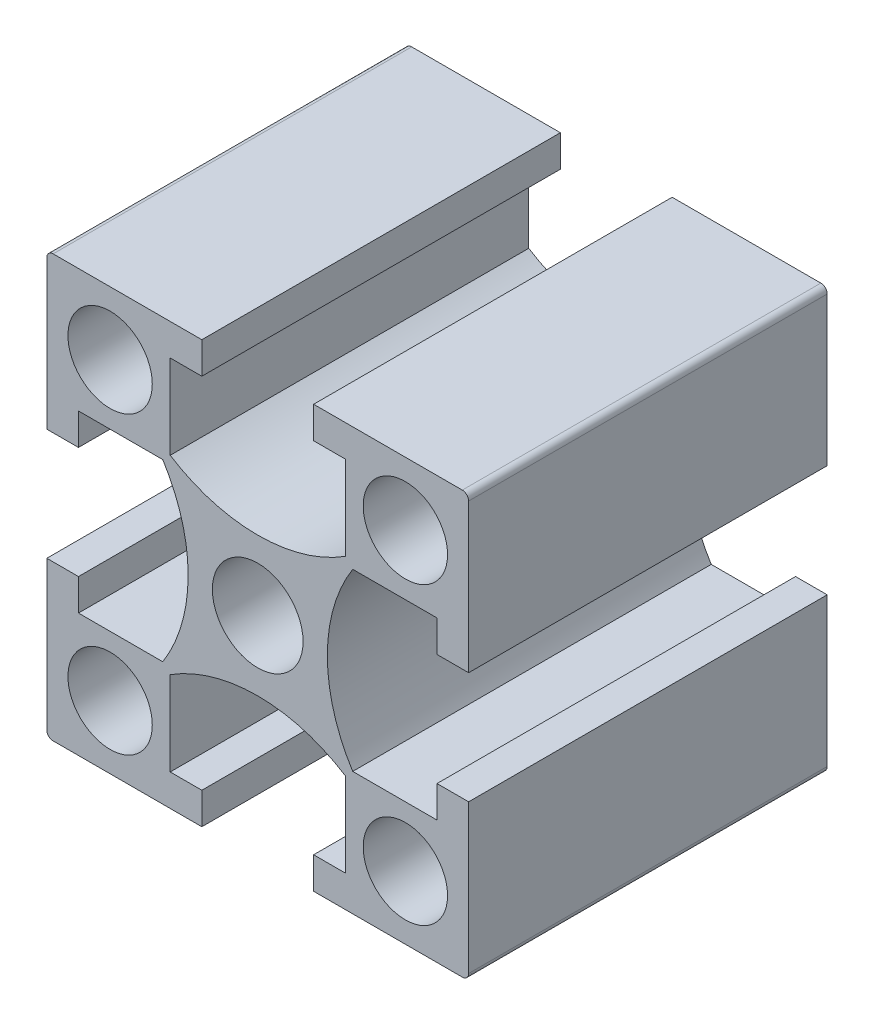
from build123d import *

# Parameters (mm, degrees)
SKETCH_1_W               = 20
SKETCH_1_H               = 20
SKETCH_1_R               = 2
SKETCH_1_R_2             = 2.15
EXTRUDE_1_DEPTH          = 17
CUT_EXTRUDE_1_REACH      = 24.113
PATTERN_CIRCULAR_1_COUNT = 4
FILLET_1_R               = 0.3
CUT_EXTRUDE_2_DEPTH      = 23.113344387
CUT_EXTRUDE_2_DEPTH_BACK = 23.113344387
SKETCH_2_R               = 2.5


with BuildPart() as part:
    # 스케치1 → 보스-돌출1 (new body)
    with BuildSketch(Plane.XY):
        Rectangle(SKETCH_1_W, SKETCH_1_H)
        with Locations((-7, -7)):
            Circle(SKETCH_1_R, mode=Mode.SUBTRACT)
        with Locations((7, -7)):
            Circle(SKETCH_1_R, mode=Mode.SUBTRACT)
        with Locations((-7, 7)):
            Circle(SKETCH_1_R, mode=Mode.SUBTRACT)
        Circle(SKETCH_1_R_2, mode=Mode.SUBTRACT)
        with Locations((7, 7)):
            Circle(SKETCH_1_R, mode=Mode.SUBTRACT)
    extrude(amount=EXTRUDE_1_DEPTH)

    # 스케치1<3> → 컷-돌출1 (cut, up to next)
    with BuildSketch(Plane.XY, mode=Mode.PRIVATE) as cut_extrude_1_sk1:
        with BuildLine():
            Line((-8.5, 2.65), (-10, 2.65))
            Line((-10, 2.65), (-10, -2.65))
            Line((-10, -2.65), (-8.5, -2.65))
            Line((-8.5, -2.65), (-8.5, -4.15))
            Line((-8.5, -4.15), (-4.503166667, -4.15))
            ThreePointArc((-4.503166667, -4.15), (-3.3, 0), (-4.503166667, 4.15))
            Line((-4.503166667, 4.15), (-8.5, 4.15))
            Line((-8.5, 4.15), (-8.5, 2.65))
        make_face()
    cut_extrude_1_tool1 = extrude(cut_extrude_1_sk1.sketch, amount=CUT_EXTRUDE_1_REACH, mode=Mode.PRIVATE) & part.part
    cut_extrude_1 = cut_extrude_1_tool1.solids().sort_by_distance((-6.606913, 0, 0))[0]
    add(cut_extrude_1, mode=Mode.SUBTRACT)

    # 원형 패턴1: 컷-돌출1 ×4 about axis
    pattern_circular_1_axis = Axis((0, 0, 17), (0, 0, -1))
    for i in range(1, PATTERN_CIRCULAR_1_COUNT):
        add(cut_extrude_1.rotate(pattern_circular_1_axis, i * 360 / PATTERN_CIRCULAR_1_COUNT), mode=Mode.SUBTRACT)

    # 필렛1
    fillet_1_edges = [part.edges().sort_by_distance(p)[0] for p in [
        (10, -10, 8.5),
        (-10, -10, 8.5),
        (-10, 10, 8.5),
        (10, 10, 8.5),
    ]]
    fillet(fillet_1_edges, radius=FILLET_1_R)

    # 스케치2 → 컷-돌출2 (cut, two sides: drawn at the far end of the back side and taken through both)
    with BuildSketch(Plane(origin=(0, 0, 0), x_dir=(0, 0, -1), z_dir=(1, 0, 0)).offset(-CUT_EXTRUDE_2_DEPTH_BACK)):
        with Locations((-8.5, 0)):
            Circle(SKETCH_2_R)
    extrude(amount=CUT_EXTRUDE_2_DEPTH + CUT_EXTRUDE_2_DEPTH_BACK, mode=Mode.SUBTRACT)


solid = part.part
